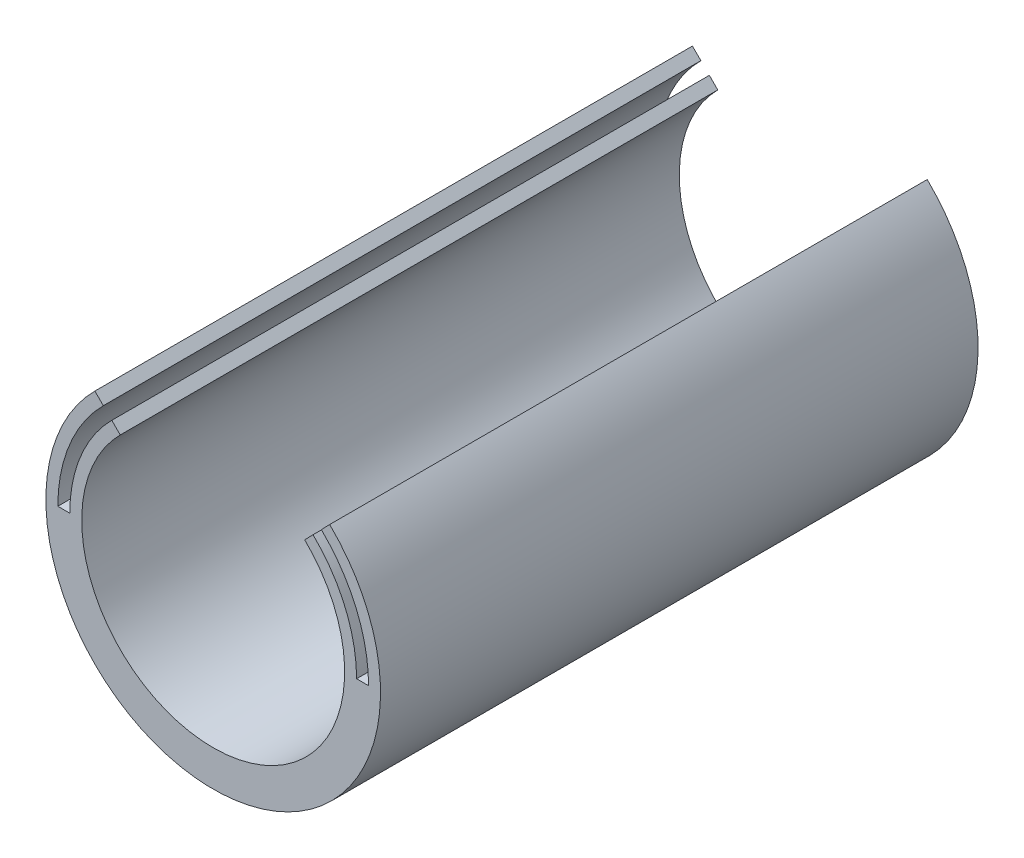
from build123d import *

# Parameters (mm, degrees)
EXTRU_MINCE2_DEPTH      = 100
ENL_V_MAT_EXTRU_2_DEPTH = 100


with BuildPart() as part:
    # Esquisse3 → Extru.-Mince2 (new body)
    with BuildSketch(Plane.XY):
        with BuildLine():
            ThreePointArc((15.315208394, 15.793808656), (20.193436478, 8.730700042), (21.997396912, 0.338421491))
            ThreePointArc((21.997396912, 0.338421491), (0.169215751, -21.999349218), (-22, 0))
            ThreePointArc((-22, 0), (-20.325349715, 8.419035512), (-15.556349186, 15.556349186))
            Line((-15.556349186, 15.556349186), (-19.798989873, 19.798989873))
            ThreePointArc((-19.798989873, 19.798989873), (-25.86862691, 10.715136106), (-28, 0))
            ThreePointArc((-28, 0), (0.215365501, -27.999171732), (27.996686979, 0.430718261))
            ThreePointArc((27.996686979, 0.430718261), (25.700737335, 11.111800054), (19.49208341, 20.101211017))
            Line((19.49208341, 20.101211017), (15.315208394, 15.793808656))
        make_face()
    extrude(amount=EXTRU_MINCE2_DEPTH)

    # Esquisse7 → Enlèv. mat.-Extru.2 (cut)
    with BuildSketch(Plane.XY.offset(100)):
        with BuildLine():
            Line((-26, 0), (-24, 0))
            ThreePointArc((-24, 0), (0, 24), (24, 0))
            Line((24, 0), (26, 0))
            ThreePointArc((26, 0), (0, 26), (-26, 0))
        make_face()
    extrude(amount=-ENL_V_MAT_EXTRU_2_DEPTH, mode=Mode.SUBTRACT)


solid = part.part
